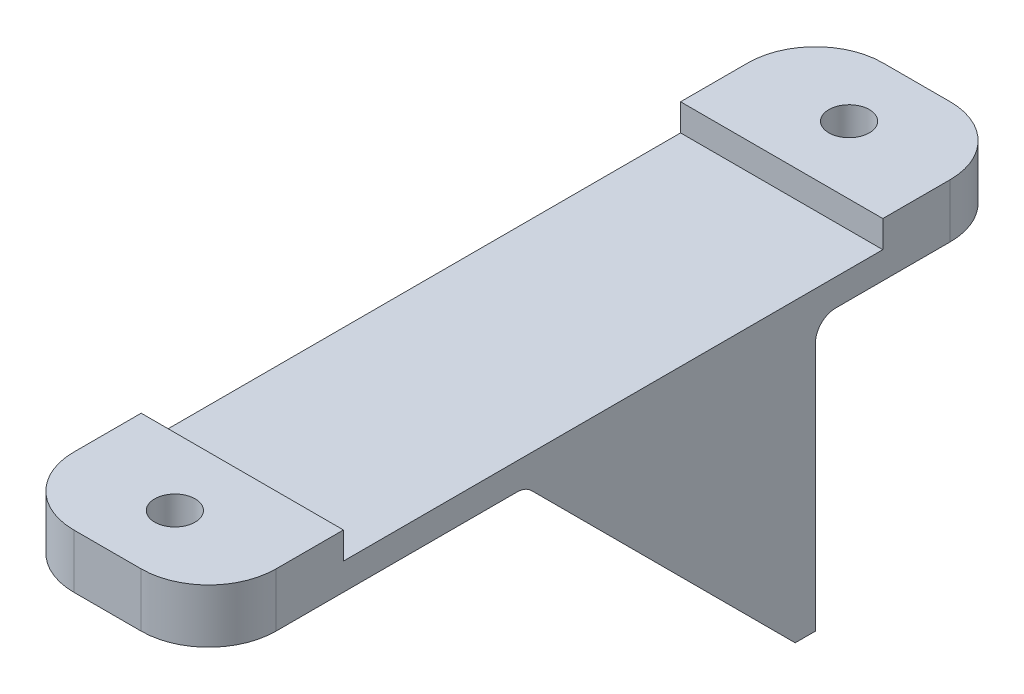
from build123d import *

# Parameters (mm, degrees)
SKETCH1_W           = 30
SKETCH1_H           = 120
BOSS_EXTRUDE1_DEPTH = 8
SKETCH2_W           = 30
SKETCH2_H           = 80
CUT_EXTRUDE1_DEPTH  = 4
SKETCH3_W           = 30
SKETCH3_H           = 3
BOSS_EXTRUDE2_DEPTH = 40
SKETCH4_R           = 9.1
CUT_EXTRUDE2_DEPTH  = 40
BOSS_EXTRUDE3_DEPTH = 2.5
BOSS_EXTRUDE4_DEPTH = 2.5
SKETCH7_R           = 3
CUT_EXTRUDE3_DEPTH  = 131
FILLET1_R           = 10
FILLET2_R           = 3
FILLET3_R           = 3


with BuildPart() as part:
    # Sketch1 → Boss-Extrude1 (new body)
    with BuildSketch(Plane(origin=(0, 0, 0), x_dir=(1, 0, 0), z_dir=(0, 1, 0))):
        with Locations((15, 60)):
            Rectangle(SKETCH1_W, SKETCH1_H)
    extrude(amount=BOSS_EXTRUDE1_DEPTH)

    # Sketch2 → Cut-Extrude1 (cut)
    with BuildSketch(Plane(origin=(0, 8, 0), x_dir=(1, 0, 0), z_dir=(0, 1, 0))):
        with Locations((15, 60)):
            Rectangle(SKETCH2_W, SKETCH2_H)
    extrude(amount=-CUT_EXTRUDE1_DEPTH, mode=Mode.SUBTRACT)

    # Sketch3 → Boss-Extrude2 (add)
    with BuildSketch(Plane.XZ):
        with Locations((15, -88.5)):
            Rectangle(SKETCH3_W, SKETCH3_H)
    extrude(amount=BOSS_EXTRUDE2_DEPTH)

    # Sketch4 → Cut-Extrude2 (cut)
    with BuildSketch(Plane.XY.offset(-87)):
        with Locations((15, -20)):
            Circle(SKETCH4_R)
    extrude(amount=-CUT_EXTRUDE2_DEPTH, mode=Mode.SUBTRACT)

    # Sketch5 → Boss-Extrude3 (add)
    with BuildSketch(Plane(origin=(30, 0, 0), x_dir=(0, 0, -1), z_dir=(1, 0, 0))):
        Polygon((87, -40), (47, 0), (87, 0), align=None)
    extrude(amount=-BOSS_EXTRUDE3_DEPTH)

    # Sketch6 → Boss-Extrude4 (add)
    with BuildSketch(Plane.ZY):
        Polygon((-47, 0), (-87, -40), (-87, 0), align=None)
    extrude(amount=-BOSS_EXTRUDE4_DEPTH)

    # Sketch7 → Cut-Extrude3 (cut, through all)
    with BuildSketch(Plane(origin=(0, 0, 0), x_dir=(-1, 0, 0), z_dir=(0, -1, 0))):
        with Locations(Location((-15, 10, 0), (0, 0, 90))):
            Circle(SKETCH7_R)
        with Locations(Location((-15, 110, 0), (0, 0, 90))):
            Circle(SKETCH7_R)
    extrude(amount=-CUT_EXTRUDE3_DEPTH, mode=Mode.SUBTRACT)

    # Fillet1
    fillet1_edges = [part.edges().sort_by_distance(p)[0] for p in [
        (0, 4, -120),
        (30, 4, -120),
        (30, 4, 0),
        (0, 4, 0),
    ]]
    fillet(fillet1_edges, radius=FILLET1_R)

    # Fillet2
    fillet2_edges = [part.edges().sort_by_distance(p)[0] for p in [
        (15, 0, -90),
    ]]
    fillet(fillet2_edges, radius=FILLET2_R)

    # Fillet3
    fillet3_edges = [part.edges().sort_by_distance(p)[0] for p in [
        (28.75, 0, -47),
        (1.25, 0, -47),
    ]]
    fillet(fillet3_edges, radius=FILLET3_R)


solid = part.part
